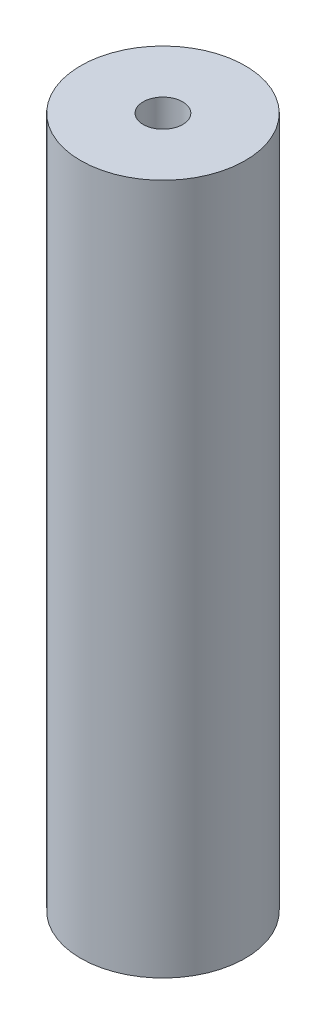
from build123d import *

# Parameters (mm, degrees)
SKETCH1_R           = 12.5
SKETCH1_R_2         = 3
BOSS_EXTRUDE1_DEPTH = 105


with BuildPart() as part:
    # Sketch1 → Boss-Extrude1 (new body)
    with BuildSketch(Plane(origin=(0, 0, 0), x_dir=(1, 0, 0), z_dir=(0, 1, 0))):
        with Locations(Location((0, 0, 0), (0, 0, 270))):
            Circle(SKETCH1_R)
        with Locations(Location((0, 0, 0), (0, 0, 270))):
            Circle(SKETCH1_R_2, mode=Mode.SUBTRACT)
    extrude(amount=BOSS_EXTRUDE1_DEPTH)


solid = part.part
